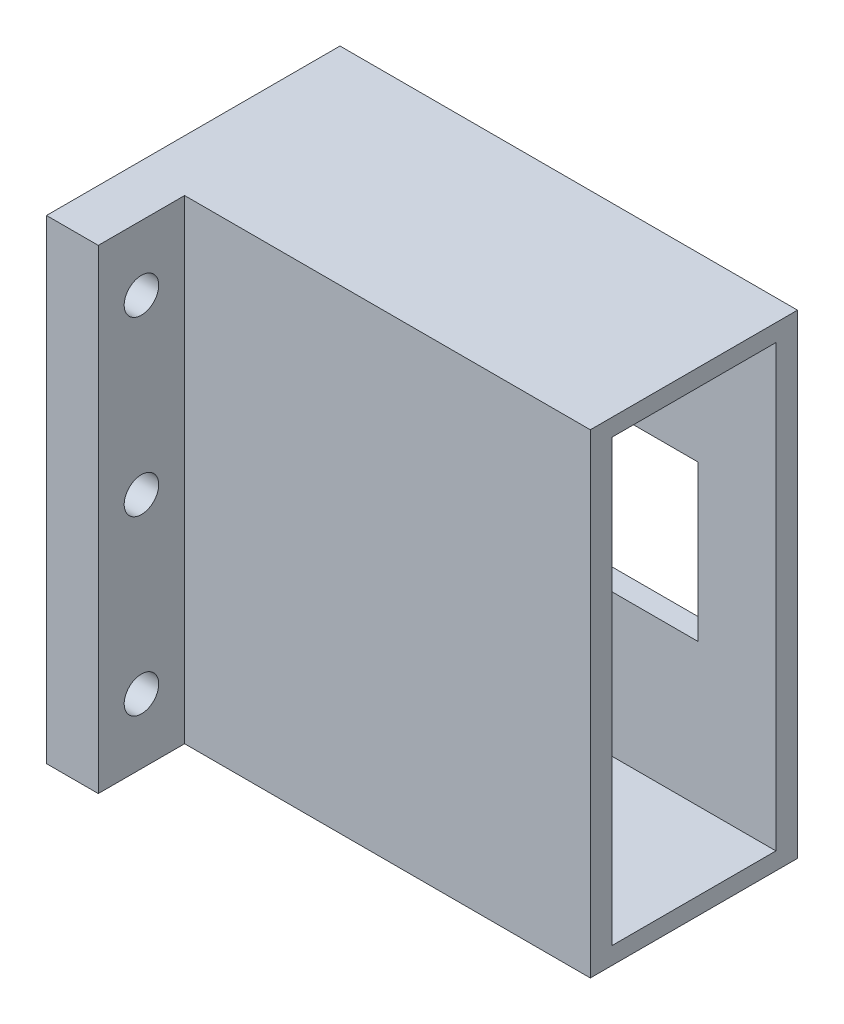
from build123d import *

# Parameters (mm, degrees)
SKETCH1_W           = 26.5
SKETCH1_H           = 27.5
BOSS_EXTRUDE1_DEPTH = 12
SKETCH3_W           = 9.5
SKETCH3_H           = 25.5
CUT_EXTRUDE1_DEPTH  = 24.5
SKETCH4_W           = 9
SKETCH4_H           = 9
CUT_EXTRUDE2_DEPTH  = 3.5
SKETCH6_W           = 3
SKETCH6_H           = 27.5
BOSS_EXTRUDE2_DEPTH = 5
SKETCH7_R           = 1
CUT_EXTRUDE3_DEPTH  = 5


with BuildPart() as part:
    # Sketch1 → Boss-Extrude1 (new body)
    with BuildSketch(Plane.XY):
        Rectangle(SKETCH1_W, SKETCH1_H)
    extrude(amount=BOSS_EXTRUDE1_DEPTH)

    # Sketch3 → Cut-Extrude1 (cut)
    with BuildSketch(Plane(origin=(13.25, 0, 0), x_dir=(0, 0, -1), z_dir=(1, 0, 0))):
        with Locations((-6, 0)):
            Rectangle(SKETCH3_W, SKETCH3_H)
    extrude(amount=-CUT_EXTRUDE1_DEPTH, mode=Mode.SUBTRACT)

    # Sketch4 → Cut-Extrude2 (cut)
    with BuildSketch(Plane(origin=(0, 0, 0), x_dir=(-1, 0, 0), z_dir=(0, 0, -1))):
        with Locations((-4.25, 0)):
            Rectangle(SKETCH4_W, SKETCH4_H)
    extrude(amount=-CUT_EXTRUDE2_DEPTH, mode=Mode.SUBTRACT)

    # Sketch6 → Boss-Extrude2 (add)
    with BuildSketch(Plane.XY.offset(12)):
        with Locations((-11.75, 0)):
            Rectangle(SKETCH6_W, SKETCH6_H)
    extrude(amount=BOSS_EXTRUDE2_DEPTH)

    # Sketch7 → Cut-Extrude3 (cut)
    with BuildSketch(Plane(origin=(-10.25, 0, 0), x_dir=(0, 0, -1), z_dir=(1, 0, 0))):
        with Locations(Location((-14.5, -10, 0), (0, 0, 90))):
            Circle(SKETCH7_R)
        with Locations(Location((-14.5, 0, 0), (0, 0, 90))):
            Circle(SKETCH7_R)
        with Locations(Location((-14.5, 10, 0), (0, 0, 90))):
            Circle(SKETCH7_R)
    extrude(amount=-CUT_EXTRUDE3_DEPTH, mode=Mode.SUBTRACT)


solid = part.part
